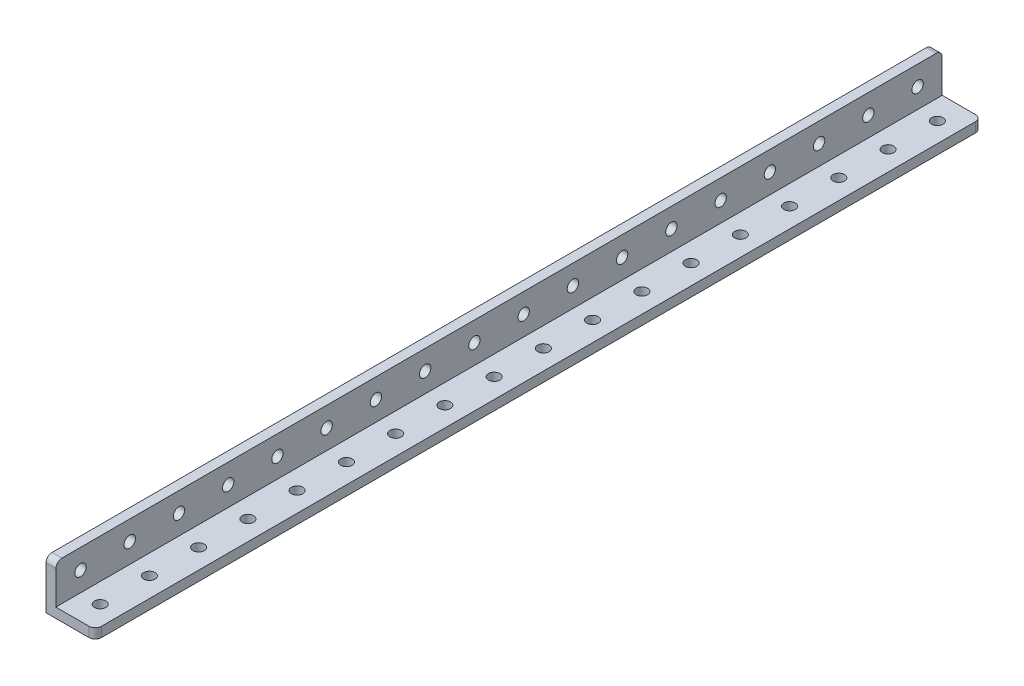
from build123d import *

# Parameters (mm, degrees)
BOSS_EXTRUDE1_DEPTH = 288
SKETCH2_R           = 1.85
CUT_EXTRUDE1_DEPTH  = 289.887521364
SKETCH3_R           = 1.85
CUT_EXTRUDE2_DEPTH  = 289.887521364
FILLET1_R           = 2


with BuildPart() as part:
    # Sketch1 → Boss-Extrude1 (new body)
    with BuildSketch(Plane.XY):
        Polygon((0, 16), (0, 0), (16, 0), (16, 3.2), (3.2, 3.2), (3.2, 16), align=None)
    extrude(amount=-BOSS_EXTRUDE1_DEPTH)

    # Sketch2 → Cut-Extrude1 (cut, through all)
    with BuildSketch(Plane.ZY):
        with Locations(Location((-88, 9.6, 0), (0, 0, 180))):
            Circle(SKETCH2_R)
        with Locations(Location((-104, 9.6, 0), (0, 0, 180))):
            Circle(SKETCH2_R)
        with Locations(Location((-120, 9.6, 0), (0, 0, 180))):
            Circle(SKETCH2_R)
        with Locations(Location((-136, 9.6, 0), (0, 0, 180))):
            Circle(SKETCH2_R)
        with Locations(Location((-8, 9.6, 0), (0, 0, 270))):
            Circle(SKETCH2_R)
        with Locations(Location((-24, 9.6, 0), (0, 0, 270))):
            Circle(SKETCH2_R)
        with Locations(Location((-40, 9.6, 0), (0, 0, 270))):
            Circle(SKETCH2_R)
        with Locations(Location((-56, 9.6, 0), (0, 0, 270))):
            Circle(SKETCH2_R)
        with Locations(Location((-72, 9.6, 0), (0, 0, 270))):
            Circle(SKETCH2_R)
        with Locations(Location((-231.999996985, 9.624060502, 0), (0, 0, 180))):
            Circle(SKETCH2_R)
        with Locations(Location((-247.999996482, 9.628070586, 0), (0, 0, 180))):
            Circle(SKETCH2_R)
        with Locations(Location((-263.99999598, 9.63208067, 0), (0, 0, 180))):
            Circle(SKETCH2_R)
        with Locations(Location((-279.999995477, 9.636090754, 0), (0, 0, 180))):
            Circle(SKETCH2_R)
        with Locations(Location((-151.999999497, 9.604010084, 0), (0, 0, 270))):
            Circle(SKETCH2_R)
        with Locations(Location((-167.999998995, 9.608020167, 0), (0, 0, 270))):
            Circle(SKETCH2_R)
        with Locations(Location((-183.999998492, 9.612030251, 0), (0, 0, 270))):
            Circle(SKETCH2_R)
        with Locations(Location((-199.99999799, 9.616040335, 0), (0, 0, 270))):
            Circle(SKETCH2_R)
        with Locations(Location((-215.999997487, 9.620050419, 0), (0, 0, 270))):
            Circle(SKETCH2_R)
    extrude(amount=-CUT_EXTRUDE1_DEPTH, mode=Mode.SUBTRACT)

    # Sketch3 → Cut-Extrude2 (cut, through all)
    with BuildSketch(Plane.XZ):
        with Locations(Location((9.6, -88, 0), (0, 0, 180))):
            Circle(SKETCH3_R)
        with Locations(Location((9.6, -104, 0), (0, 0, 180))):
            Circle(SKETCH3_R)
        with Locations(Location((9.6, -120, 0), (0, 0, 180))):
            Circle(SKETCH3_R)
        with Locations(Location((9.6, -136, 0), (0, 0, 180))):
            Circle(SKETCH3_R)
        with Locations(Location((9.6, -8, 0), (0, 0, 270))):
            Circle(SKETCH3_R)
        with Locations(Location((9.6, -24, 0), (0, 0, 270))):
            Circle(SKETCH3_R)
        with Locations(Location((9.6, -40, 0), (0, 0, 270))):
            Circle(SKETCH3_R)
        with Locations(Location((9.6, -56, 0), (0, 0, 270))):
            Circle(SKETCH3_R)
        with Locations(Location((9.6, -72, 0), (0, 0, 270))):
            Circle(SKETCH3_R)
        with Locations(Location((9.6, -232, 0), (0, 0, 180))):
            Circle(SKETCH3_R)
        with Locations(Location((9.6, -248, 0), (0, 0, 180))):
            Circle(SKETCH3_R)
        with Locations(Location((9.6, -264, 0), (0, 0, 180))):
            Circle(SKETCH3_R)
        with Locations(Location((9.6, -280, 0), (0, 0, 180))):
            Circle(SKETCH3_R)
        with Locations(Location((9.6, -152, 0), (0, 0, 270))):
            Circle(SKETCH3_R)
        with Locations(Location((9.6, -168, 0), (0, 0, 270))):
            Circle(SKETCH3_R)
        with Locations(Location((9.6, -184, 0), (0, 0, 270))):
            Circle(SKETCH3_R)
        with Locations(Location((9.6, -200, 0), (0, 0, 270))):
            Circle(SKETCH3_R)
        with Locations(Location((9.6, -216, 0), (0, 0, 270))):
            Circle(SKETCH3_R)
    extrude(amount=-CUT_EXTRUDE2_DEPTH, mode=Mode.SUBTRACT)

    # Fillet1
    fillet1_edges = [part.edges().sort_by_distance(p)[0] for p in [
        (16, 1.6, -288),
        (1.6, 16, -288),
        (16, 1.6, 0),
        (1.6, 16, 0),
    ]]
    fillet(fillet1_edges, radius=FILLET1_R)


solid = part.part
